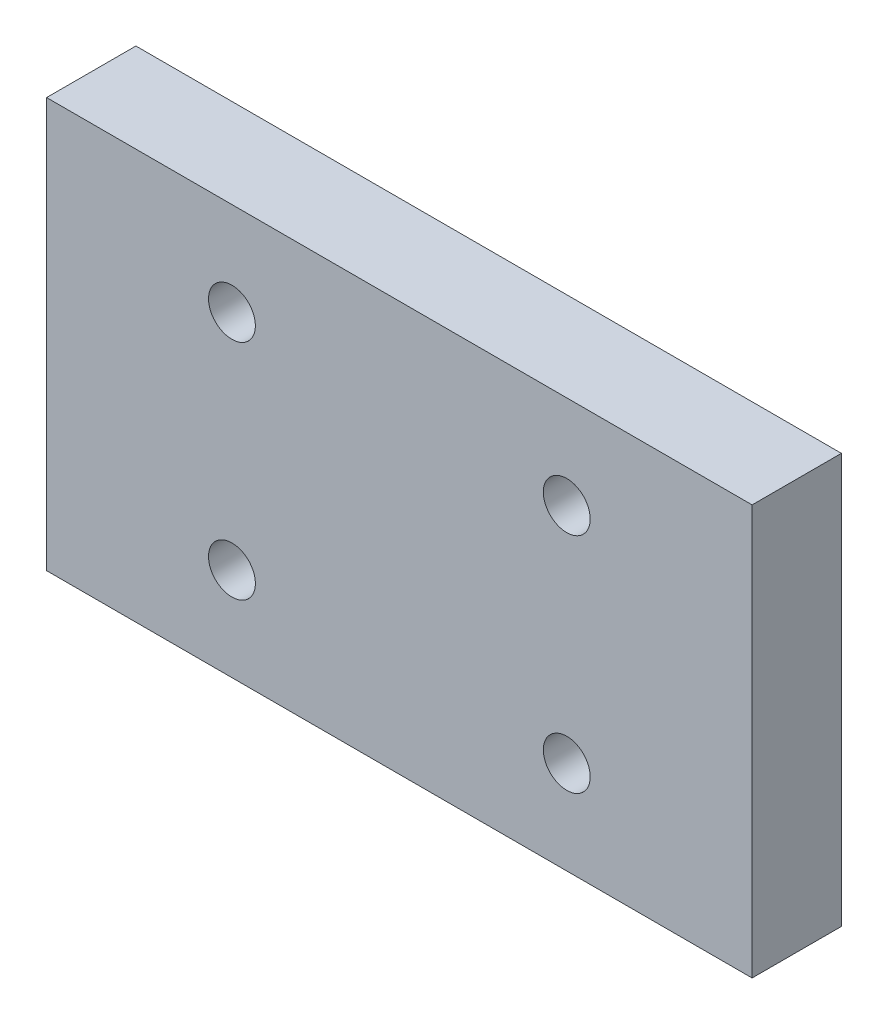
from build123d import *

# Parameters (mm, degrees)
SKETCH1_W           = 63.21181056
SKETCH1_H           = 36.711863216
SKETCH1_R           = 2.1
BOSS_EXTRUDE1_DEPTH = 8


with BuildPart() as part:
    # Sketch1 → Boss-Extrude1 (new body)
    with BuildSketch(Plane.XY):
        with Locations((26.145476582, -156)):
            Rectangle(SKETCH1_W, SKETCH1_H)
        with Locations((11.145476582, -146)):
            Circle(SKETCH1_R, mode=Mode.SUBTRACT)
        with Locations((41.145476582, -146)):
            Circle(SKETCH1_R, mode=Mode.SUBTRACT)
        with Locations((11.145476582, -166)):
            Circle(SKETCH1_R, mode=Mode.SUBTRACT)
        with Locations((41.145476582, -166)):
            Circle(SKETCH1_R, mode=Mode.SUBTRACT)
    extrude(amount=BOSS_EXTRUDE1_DEPTH)


solid = part.part
